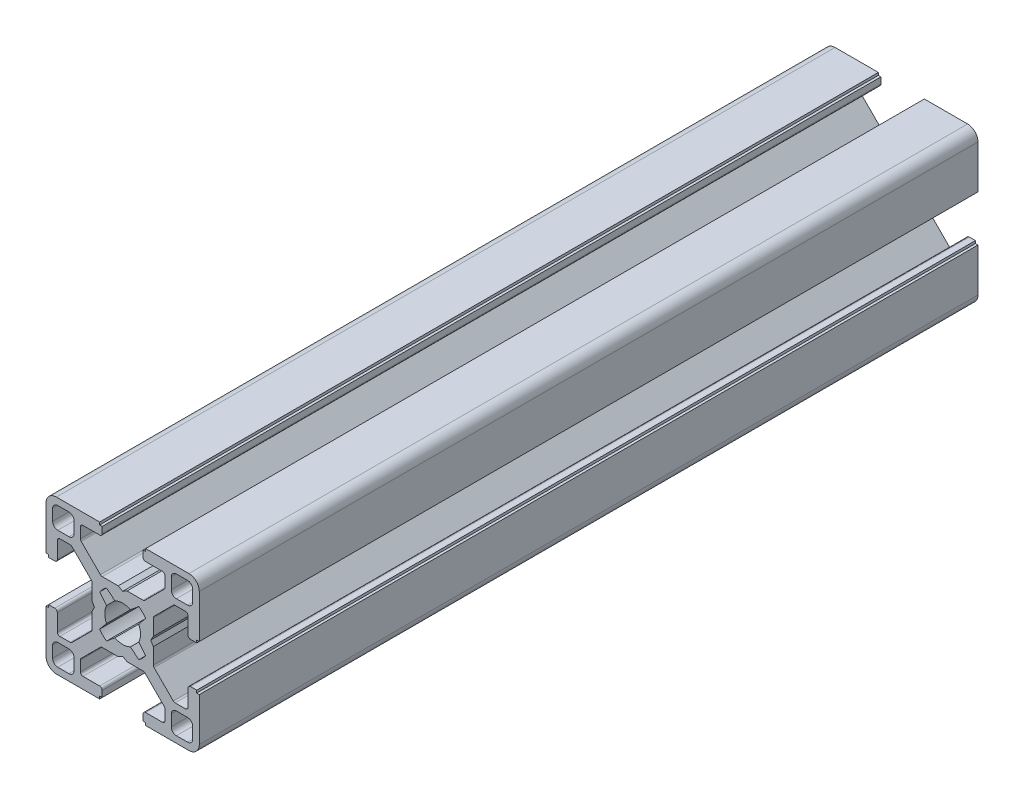
from build123d import *

# Parameters (mm, degrees)
BOSS_EXTRUDE1_DEPTH = 76.2
CIRPATTERN1_COUNT   = 4


with BuildPart() as part:
    # Sketch3 → Boss-Extrude1 (new, symmetric)
    with BuildSketch(Plane.XY):
        with BuildLine():
            Line((-4.503841895, 3.156803476), (-3.14772708, 1.530298739))
            ThreePointArc((-3.14772708, 1.530298739), (-3.410794979, 0.785160882), (-3.5, 0))
            Line((-3.5, 0), (-5.5, 0))
            Line((-5.5, 0), (-6, 0.866025404))
            Line((-6, 0.866025404), (-6, 3.996841995))
            ThreePointArc((-6, 3.996841995), (-6.038060234, 4.188183711), (-6.146446609, 4.350395385))
            Line((-6.146446609, 4.350395385), (-9.917104615, 8.121053391))
            ThreePointArc((-9.917104615, 8.121053391), (-10.079316289, 8.229439766), (-10.270658005, 8.2675))
            Line((-10.270658005, 8.2675), (-12.29, 8.2675))
            ThreePointArc((-12.29, 8.2675), (-12.643553391, 8.121053391), (-12.79, 7.7675))
            Line((-12.79, 7.7675), (-12.79, 4.5))
            ThreePointArc((-12.79, 4.5), (-12.936446609, 4.146446609), (-13.29, 4))
            Line((-13.29, 4), (-14.5, 4))
            Line((-14.5, 4), (-14.5, 4.5))
            Line((-14.5, 4.5), (-15, 4.5))
            Line((-15, 4.5), (-15, 12.968))
            ThreePointArc((-15, 12.968), (-14.404840979, 14.404840979), (-12.968, 15))
            Line((-12.968, 15), (-4.5, 15))
            Line((-4.5, 15), (-4.5, 14.5))
            Line((-4.5, 14.5), (-4, 14.5))
            Line((-4, 14.5), (-4, 13.29))
            ThreePointArc((-4, 13.29), (-4.146446609, 12.936446609), (-4.5, 12.79))
            Line((-4.5, 12.79), (-7.7675, 12.79))
            ThreePointArc((-7.7675, 12.79), (-8.121053391, 12.643553391), (-8.2675, 12.29))
            Line((-8.2675, 12.29), (-8.2675, 10.270658005))
            ThreePointArc((-8.2675, 10.270658005), (-8.229439766, 10.079316289), (-8.121053391, 9.917104615))
            Line((-8.121053391, 9.917104615), (-4.350395385, 6.146446609))
            ThreePointArc((-4.350395385, 6.146446609), (-4.188183711, 6.038060234), (-3.996841995, 6))
            Line((-3.996841995, 6), (-0.866025404, 6))
            Line((-0.866025404, 6), (0, 5.5))
            Line((0, 5.5), (0, 3.5))
            ThreePointArc((0, 3.5), (-0.785160882, 3.410794979), (-1.530298739, 3.14772708))
            Line((-1.530298739, 3.14772708), (-3.156803476, 4.503841895))
            ThreePointArc((-3.156803476, 4.503841895), (-3.889087297, 3.889087297), (-4.503841895, 3.156803476))
        make_face()
        with BuildLine():
            Line((-12.705, 9.5135), (-10.5135, 9.5135))
            ThreePointArc((-10.5135, 9.5135), (-9.806393219, 9.806393219), (-9.5135, 10.5135))
            Line((-9.5135, 10.5135), (-9.5135, 12.705))
            ThreePointArc((-9.5135, 12.705), (-9.806393219, 13.412106781), (-10.5135, 13.705))
            Line((-10.5135, 13.705), (-12.705, 13.705))
            ThreePointArc((-12.705, 13.705), (-13.412106781, 13.412106781), (-13.705, 12.705))
            Line((-13.705, 12.705), (-13.705, 10.5135))
            ThreePointArc((-13.705, 10.5135), (-13.412106781, 9.806393219), (-12.705, 9.5135))
        make_face(mode=Mode.SUBTRACT)
    boss_extrude1 = extrude(amount=BOSS_EXTRUDE1_DEPTH, both=True)

    # CirPattern1: Boss-Extrude1 ×4 about axis
    cirpattern1_axis = Axis((0, 0, 0), (0, 0, 1))
    for i in range(1, CIRPATTERN1_COUNT):
        add(boss_extrude1.rotate(cirpattern1_axis, i * 360 / CIRPATTERN1_COUNT))


solid = part.part
